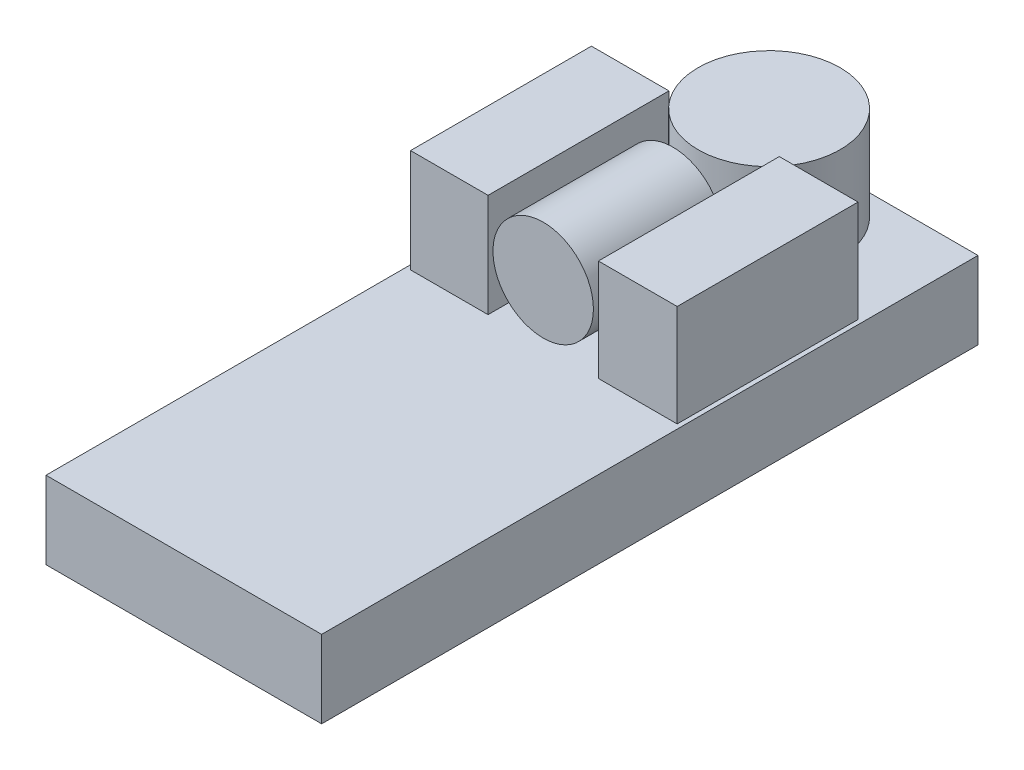
from build123d import *

# Parameters (mm, degrees)
SKETCH1_W           = 21.336
SKETCH1_H           = 50.8
BOSS_EXTRUDE1_DEPTH = 5.999988
SKETCH4_R           = 5.5000017
BOSS_EXTRUDE4_DEPTH = 7.254
SKETCH5_W           = 6
SKETCH5_H           = 14
BOSS_EXTRUDE5_DEPTH = 8
SKETCH8_W           = 6.096
SKETCH8_H           = 14
BOSS_EXTRUDE6_DEPTH = 7.874
SKETCH12_R          = 3.886840465
BOSS_EXTRUDE8_DEPTH = 10.048


with BuildPart() as part:
    # Sketch1 → Boss-Extrude1 (new body)
    with BuildSketch(Plane(origin=(0, 0, 0), x_dir=(1, 0, 0), z_dir=(0, 1, 0))):
        with Locations((10.668, 25.4)):
            Rectangle(SKETCH1_W, SKETCH1_H)
    extrude(amount=BOSS_EXTRUDE1_DEPTH)



with BuildPart() as body_2:
    # Sketch4 → Boss-Extrude4 (new body)
    with BuildSketch(Plane(origin=(0, 5.999988, 0), x_dir=(1, 0, 0), z_dir=(0, 1, 0))):
        with Locations((10.668, 45.300011)):
            Circle(SKETCH4_R)
    extrude(amount=BOSS_EXTRUDE4_DEPTH)


with BuildPart() as part_1:
    add(part.part)

    add(body_2.part)  # Boss-Extrude5 merges body 2
    # Sketch5 → Boss-Extrude5 (add)
    with BuildSketch(Plane(origin=(0, 5.999988, 0), x_dir=(1, 0, 0), z_dir=(0, 1, 0))):
        with Locations((3.34654218, 34.868853019)):
            Rectangle(SKETCH5_W, SKETCH5_H)
    extrude(amount=BOSS_EXTRUDE5_DEPTH)

    # Sketch8 → Boss-Extrude6 (add)
    with BuildSketch(Plane(origin=(0, 5.999988, 0), x_dir=(1, 0, 0), z_dir=(0, 1, 0))):
        with Locations((17.941915959, 34.862132364)):
            Rectangle(SKETCH8_W, SKETCH8_H)
    extrude(amount=BOSS_EXTRUDE6_DEPTH)


with BuildPart() as body_2_2:
    # Sketch12 → Boss-Extrude8 (new body)
    with BuildSketch(Plane.XY.offset(-27.862132364)):
        with Locations((10.62022907, 10.457914519)):
            Circle(SKETCH12_R)
    extrude(amount=-BOSS_EXTRUDE8_DEPTH)


solid = Compound([part_1.part, body_2_2.part])
